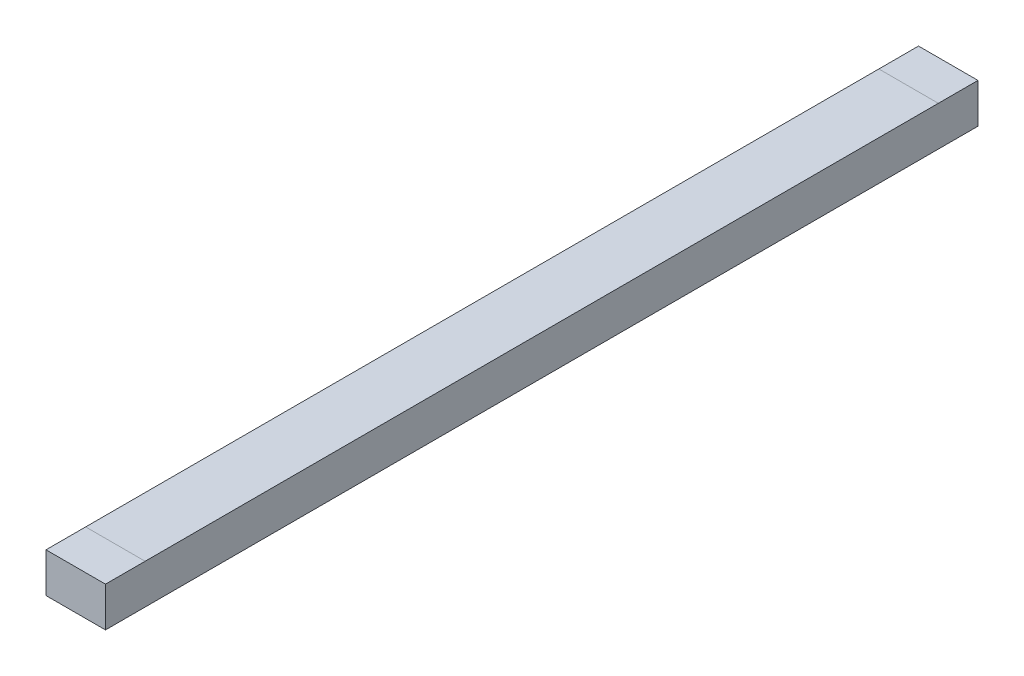
from build123d import *

# Parameters (mm, degrees)
SZKIC1_W                    = 150
SZKIC1_H                    = 100
DODANIE_WYCI_GNI_CIE1_DEPTH = 2200


with BuildPart() as part:
    # Szkic1 → Dodanie-wyciągnięcie1 (new body)
    with BuildSketch(Plane.XY):
        with Locations((75, 50)):
            Rectangle(SZKIC1_W, SZKIC1_H)
    extrude(amount=DODANIE_WYCI_GNI_CIE1_DEPTH)


solid = part.part
